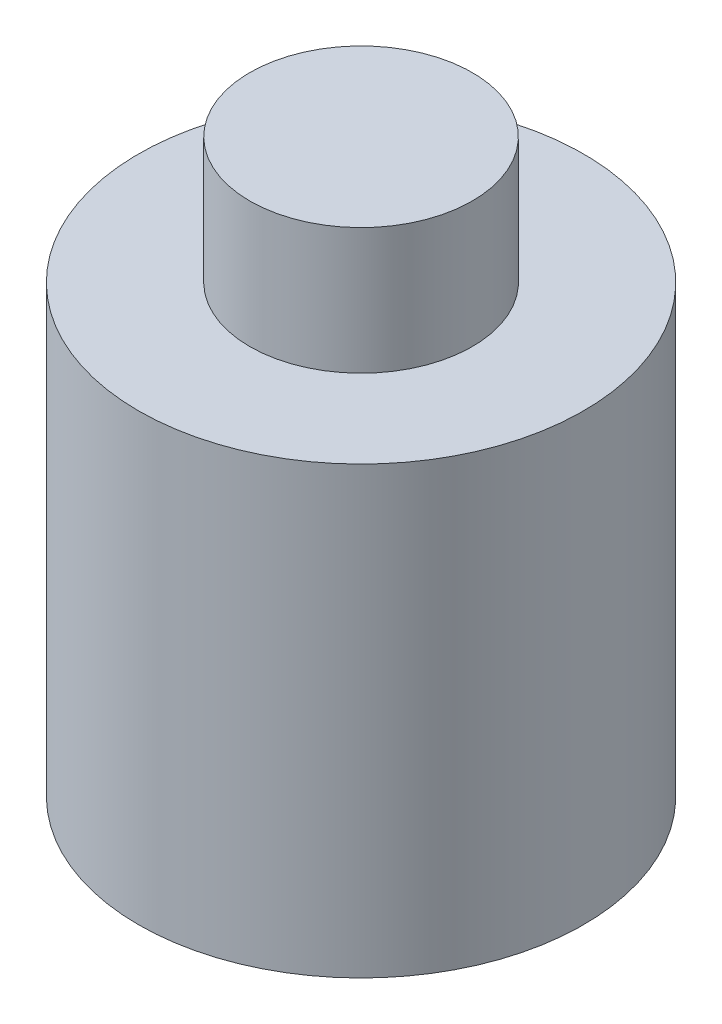
from build123d import *

# Parameters (mm, degrees)
SKETCH2_R           = 3
SKETCH2_R_2         = 1
BOSS_EXTRUDE1_DEPTH = 6
SKETCH3_R           = 1.5
BOSS_EXTRUDE2_DEPTH = 1.7


with BuildPart() as part:
    # Sketch2 → Boss-Extrude1 (new body)
    with BuildSketch(Plane(origin=(0, 0, 0), x_dir=(1, 0, 0), z_dir=(0, 1, 0))):
        with Locations(Location((0, 0, 0), (0, 0, 270))):
            Circle(SKETCH2_R)
        with Locations(Location((0, 0, 0), (0, 0, 270))):
            Circle(SKETCH2_R_2, mode=Mode.SUBTRACT)
    extrude(amount=BOSS_EXTRUDE1_DEPTH)

    # Sketch3 → Boss-Extrude2 (add)
    with BuildSketch(Plane(origin=(0, 6, 0), x_dir=(1, 0, 0), z_dir=(0, 1, 0))):
        with Locations(Location((0, 0, 0), (0, 0, 270))):
            Circle(SKETCH3_R)
    extrude(amount=BOSS_EXTRUDE2_DEPTH)


solid = part.part
